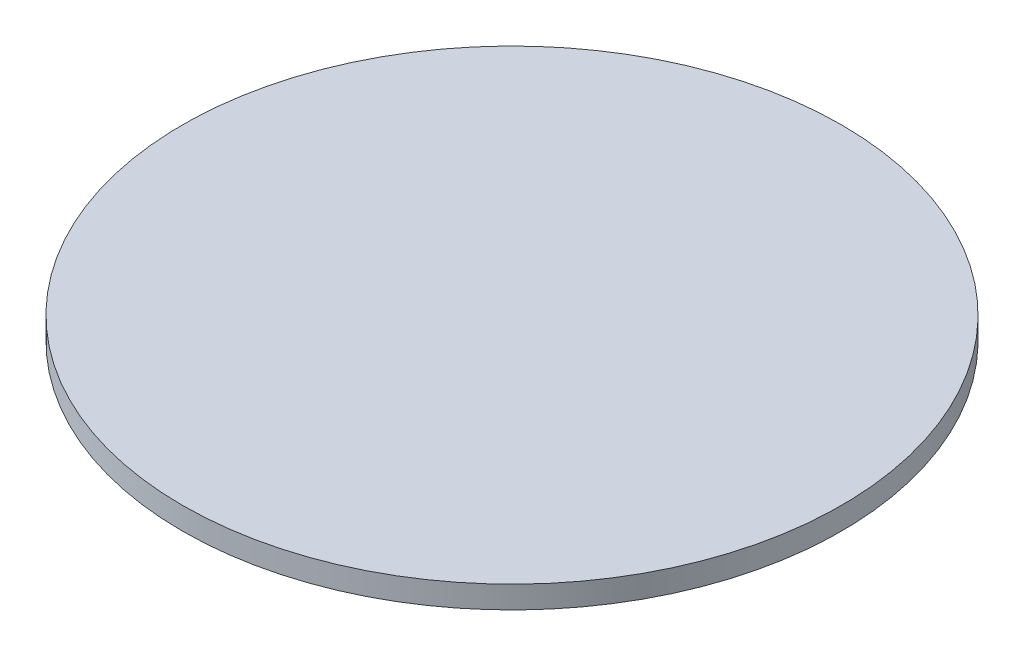
from build123d import *

# Parameters (mm, degrees)
SKETCH1_R           = 44.258248599
BOSS_EXTRUDE1_DEPTH = 3


with BuildPart() as part:
    # Sketch1 → Boss-Extrude1 (new body)
    with BuildSketch(Plane(origin=(0, 0, 0), x_dir=(1, 0, 0), z_dir=(0, 1, 0))):
        with Locations(Location((0, 0, 0), (0, 0, 270))):
            Circle(SKETCH1_R)
    extrude(amount=BOSS_EXTRUDE1_DEPTH)


solid = part.part
